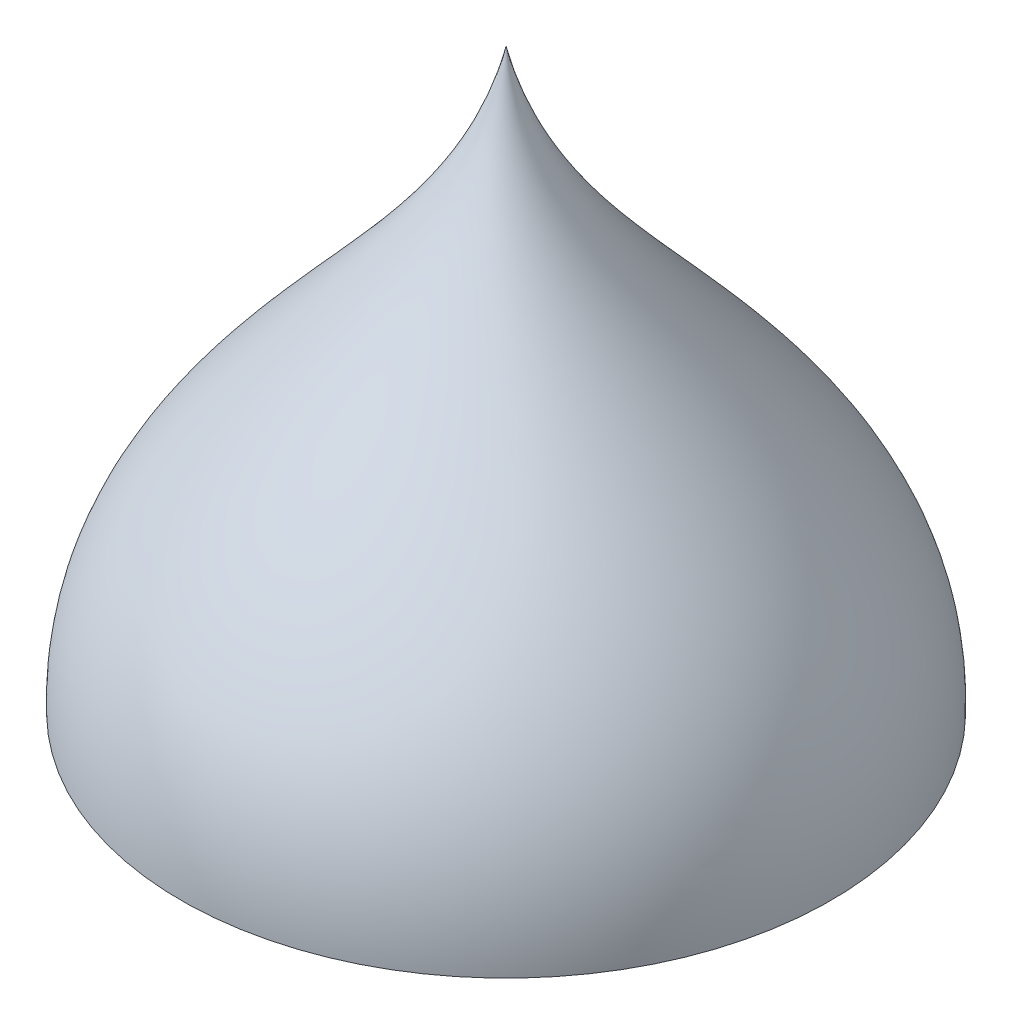
from build123d import *


with BuildPart() as part:
    # Sketch1 → Revolve1 (revolve)
    with BuildSketch(Plane.XY, mode=Mode.PRIVATE) as revolve1_sk:
        with BuildLine():
            Line((-4.5, 0), (-3.1, 0))
            Line((-3.1, 0), (-3.1, 1))
            Line((-3.1, 1), (-2, 1))
            Line((-2, 1), (-2, 0))
            Line((-2, 0), (0, 0))
            Line((0, 0), (0, 8))
            add(Edge.make_bspline(
                [(-4.5, 0), (-4.612204197, 3.383278047), (-0.696810992, 4.890034472), (0, 8)],
                knots=[0, 0, 0, 0, 1, 1, 1, 1], degree=3))
        make_face()
    revolve(revolve1_sk.sketch.rotate(Axis((0, 0, 0), (0, 1, 0)), 270), axis=Axis((0, 0, 0), (0, 1, 0)))


solid = part.part
